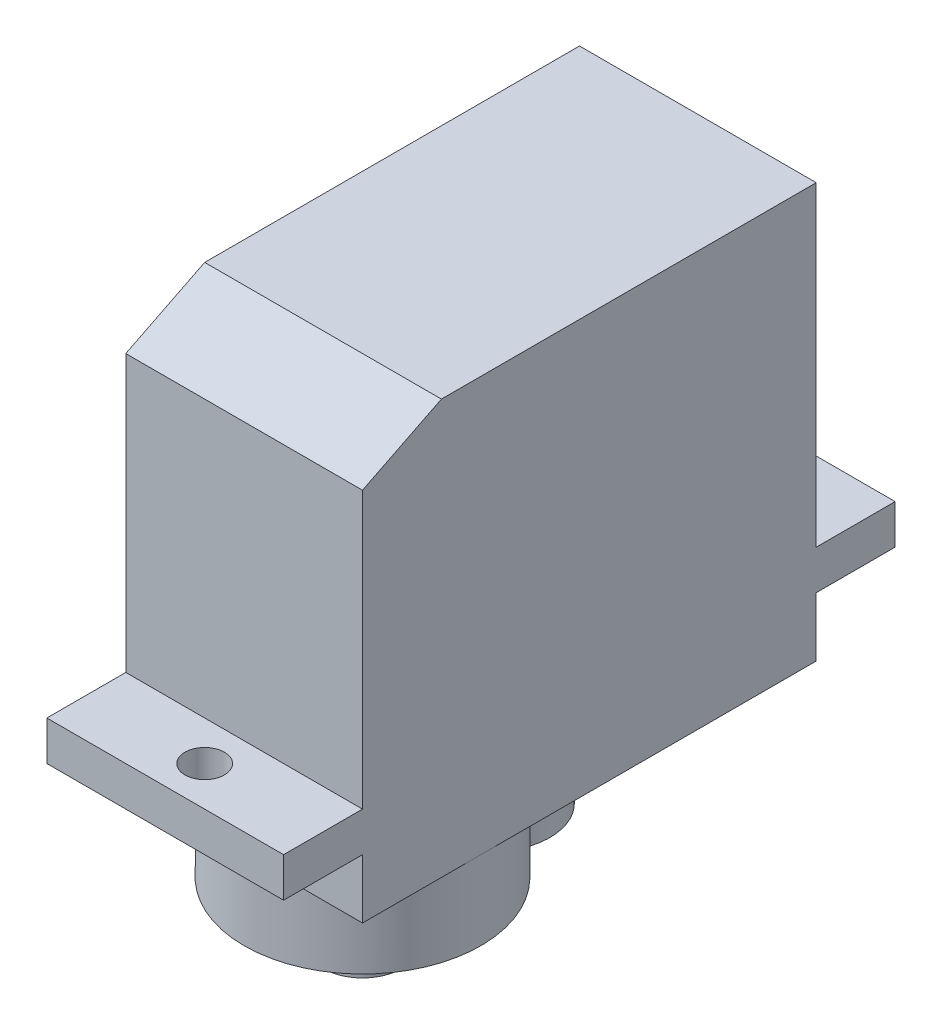
from build123d import *

# Parameters (mm, degrees)
SKETCH_1_W          = 12
SKETCH_1_H          = 23
EXTRUDE_1_DEPTH     = 21
SKETCH_2_W          = 12
SKETCH_2_H          = 4
EXTRUDE_2_DEPTH     = 2
SKETCH_3_R          = 1
CUT_EXTRUDE_2_DEPTH = 2
SKETCH_4_R          = 1
CUT_EXTRUDE_3_DEPTH = 2
EXTRUDE_3_DEPTH     = 4
SKETCH_6_R          = 2
EXTRUDE_4_DEPTH     = 3
CUT_EXTRUDE_4_DEPTH = 29.727164844


with BuildPart() as part:
    # 草图1 → 凸台-拉伸1 (new body)
    with BuildSketch(Plane(origin=(0, 0, 0), x_dir=(1, 0, 0), z_dir=(0, 1, 0))):
        Rectangle(SKETCH_1_W, SKETCH_1_H)
    extrude(amount=EXTRUDE_1_DEPTH)

    # 草图2 → 凸台-拉伸2 (add)
    with BuildSketch(Plane(origin=(0, 5, 0), x_dir=(-1, 0, 0), z_dir=(0, -1, 0))):
        with Locations((0, -13.5)):
            Rectangle(SKETCH_2_W, SKETCH_2_H)
        with Locations((0, 13.5)):
            Rectangle(SKETCH_2_W, SKETCH_2_H)
    extrude(amount=EXTRUDE_2_DEPTH)

    # 草图3 → 切除-拉伸2 (cut)
    with BuildSketch(Plane(origin=(0, 5, 0), x_dir=(1, 0, 0), z_dir=(0, 1, 0))):
        with Locations(Location((0, -13.5, 0), (0, 0, 270))):
            Circle(SKETCH_3_R)
    extrude(amount=-CUT_EXTRUDE_2_DEPTH, mode=Mode.SUBTRACT)

    # 草图4 → 切除-拉伸3 (cut)
    with BuildSketch(Plane(origin=(0, 5, 0), x_dir=(1, 0, 0), z_dir=(0, 1, 0))):
        with Locations(Location((0, 13.5, 0), (0, 0, 270))):
            Circle(SKETCH_4_R)
    extrude(amount=-CUT_EXTRUDE_3_DEPTH, mode=Mode.SUBTRACT)

    # 草图5 → 凸台-拉伸3 (add)
    with BuildSketch(Plane.XZ):
        with BuildLine():
            ThreePointArc((6, 5.5), (4.242640687, 9.742640687), (0, 11.5))
            Line((0, 11.5), (0, 2))
            ThreePointArc((0, 2), (1.655410709, 1.501922338), (2.761139354, 0.173076923))
            ThreePointArc((2.761139354, 0.173076923), (5.126735615, 2.382856767), (6, 5.5))
        make_face()
        with BuildLine():
            Line((0, 2), (0, 11.5))
            ThreePointArc((0, 11.5), (-4.242640687, 9.742640687), (-6, 5.5))
            ThreePointArc((-6, 5.5), (-5.126735615, 2.382856767), (-2.761139354, 0.173076923))
            ThreePointArc((-2.761139354, 0.173076923), (-1.655410709, 1.501922338), (0, 2))
        make_face()
        with BuildLine():
            ThreePointArc((2.761139354, 0.173076923), (1.655410709, 1.501922338), (0, 2))
            Line((0, 2), (0, -0.5))
            ThreePointArc((0, -0.5), (1.4209964, -0.329302637), (2.761139354, 0.173076923))
        make_face()
        with BuildLine():
            Line((0, -0.5), (0, 2))
            ThreePointArc((0, 2), (-1.655410709, 1.501922338), (-2.761139354, 0.173076923))
            ThreePointArc((-2.761139354, 0.173076923), (-1.4209964, -0.329302637), (0, -0.5))
        make_face()
        with BuildLine():
            ThreePointArc((2.761139354, 0.173076923), (1.4209964, -0.329302637), (0, -0.5))
            Line((0, -0.5), (0, -4))
            ThreePointArc((0, -4), (2.121320344, -3.121320344), (3, -1))
            ThreePointArc((3, -1), (2.939678389, -0.401425887), (2.761139354, 0.173076923))
        make_face()
        with BuildLine():
            Line((0, -4), (0, -0.5))
            ThreePointArc((0, -0.5), (-1.4209964, -0.329302637), (-2.761139354, 0.173076923))
            ThreePointArc((-2.761139354, 0.173076923), (-2.501922338, -2.655410709), (0, -4))
        make_face()
        with BuildLine():
            ThreePointArc((6, 5.5), (4.242640687, 9.742640687), (0, 11.5))
            Line((0, 11.5), (0, 2))
            ThreePointArc((0, 2), (1.655410709, 1.501922338), (2.761139354, 0.173076923))
            ThreePointArc((2.761139354, 0.173076923), (5.126735615, 2.382856767), (6, 5.5))
        make_face()
        with BuildLine():
            Line((0, 2), (0, 11.5))
            ThreePointArc((0, 11.5), (-4.242640687, 9.742640687), (-6, 5.5))
            ThreePointArc((-6, 5.5), (-5.126735615, 2.382856767), (-2.761139354, 0.173076923))
            ThreePointArc((-2.761139354, 0.173076923), (-1.655410709, 1.501922338), (0, 2))
        make_face()
        with BuildLine():
            ThreePointArc((2.761139354, 0.173076923), (1.655410709, 1.501922338), (0, 2))
            Line((0, 2), (0, -0.5))
            ThreePointArc((0, -0.5), (1.4209964, -0.329302637), (2.761139354, 0.173076923))
        make_face()
        with BuildLine():
            Line((0, -0.5), (0, 2))
            ThreePointArc((0, 2), (-1.655410709, 1.501922338), (-2.761139354, 0.173076923))
            ThreePointArc((-2.761139354, 0.173076923), (-1.4209964, -0.329302637), (0, -0.5))
        make_face()
        with BuildLine():
            ThreePointArc((2.761139354, 0.173076923), (1.4209964, -0.329302637), (0, -0.5))
            Line((0, -0.5), (0, -4))
            ThreePointArc((0, -4), (2.121320344, -3.121320344), (3, -1))
            ThreePointArc((3, -1), (2.939678389, -0.401425887), (2.761139354, 0.173076923))
        make_face()
        with BuildLine():
            Line((0, -4), (0, -0.5))
            ThreePointArc((0, -0.5), (-1.4209964, -0.329302637), (-2.761139354, 0.173076923))
            ThreePointArc((-2.761139354, 0.173076923), (-2.501922338, -2.655410709), (0, -4))
        make_face()
        with BuildLine():
            ThreePointArc((6, 5.5), (4.242640687, 9.742640687), (0, 11.5))
            Line((0, 11.5), (0, 2))
            ThreePointArc((0, 2), (1.655410709, 1.501922338), (2.761139354, 0.173076923))
            ThreePointArc((2.761139354, 0.173076923), (5.126735615, 2.382856767), (6, 5.5))
        make_face()
        with BuildLine():
            Line((0, 2), (0, 11.5))
            ThreePointArc((0, 11.5), (-4.242640687, 9.742640687), (-6, 5.5))
            ThreePointArc((-6, 5.5), (-5.126735615, 2.382856767), (-2.761139354, 0.173076923))
            ThreePointArc((-2.761139354, 0.173076923), (-1.655410709, 1.501922338), (0, 2))
        make_face()
        with BuildLine():
            ThreePointArc((2.761139354, 0.173076923), (1.655410709, 1.501922338), (0, 2))
            Line((0, 2), (0, -0.5))
            ThreePointArc((0, -0.5), (1.4209964, -0.329302637), (2.761139354, 0.173076923))
        make_face()
        with BuildLine():
            Line((0, -0.5), (0, 2))
            ThreePointArc((0, 2), (-1.655410709, 1.501922338), (-2.761139354, 0.173076923))
            ThreePointArc((-2.761139354, 0.173076923), (-1.4209964, -0.329302637), (0, -0.5))
        make_face()
        with BuildLine():
            ThreePointArc((2.761139354, 0.173076923), (1.4209964, -0.329302637), (0, -0.5))
            Line((0, -0.5), (0, -4))
            ThreePointArc((0, -4), (2.121320344, -3.121320344), (3, -1))
            ThreePointArc((3, -1), (2.939678389, -0.401425887), (2.761139354, 0.173076923))
        make_face()
        with BuildLine():
            Line((0, -4), (0, -0.5))
            ThreePointArc((0, -0.5), (-1.4209964, -0.329302637), (-2.761139354, 0.173076923))
            ThreePointArc((-2.761139354, 0.173076923), (-2.501922338, -2.655410709), (0, -4))
        make_face()
    extrude(amount=EXTRUDE_3_DEPTH)

    # 草图6 → 凸台-拉伸4 (add)
    with BuildSketch(Plane.XZ.offset(4)):
        with Locations(Location((0, 5.5, 0), (0, 0, 270))):
            Circle(SKETCH_6_R)
    extrude(amount=EXTRUDE_4_DEPTH)

    # 草图7 → 切除-拉伸4 (cut, through all)
    with BuildSketch(Plane(origin=(6, 0, 0), x_dir=(0, 0, -1), z_dir=(1, 0, 0))):
        Polygon((-11.5, 21), (-11.5, 19), (-7.5, 21), align=None)
    extrude(amount=-CUT_EXTRUDE_4_DEPTH, mode=Mode.SUBTRACT)


solid = part.part
